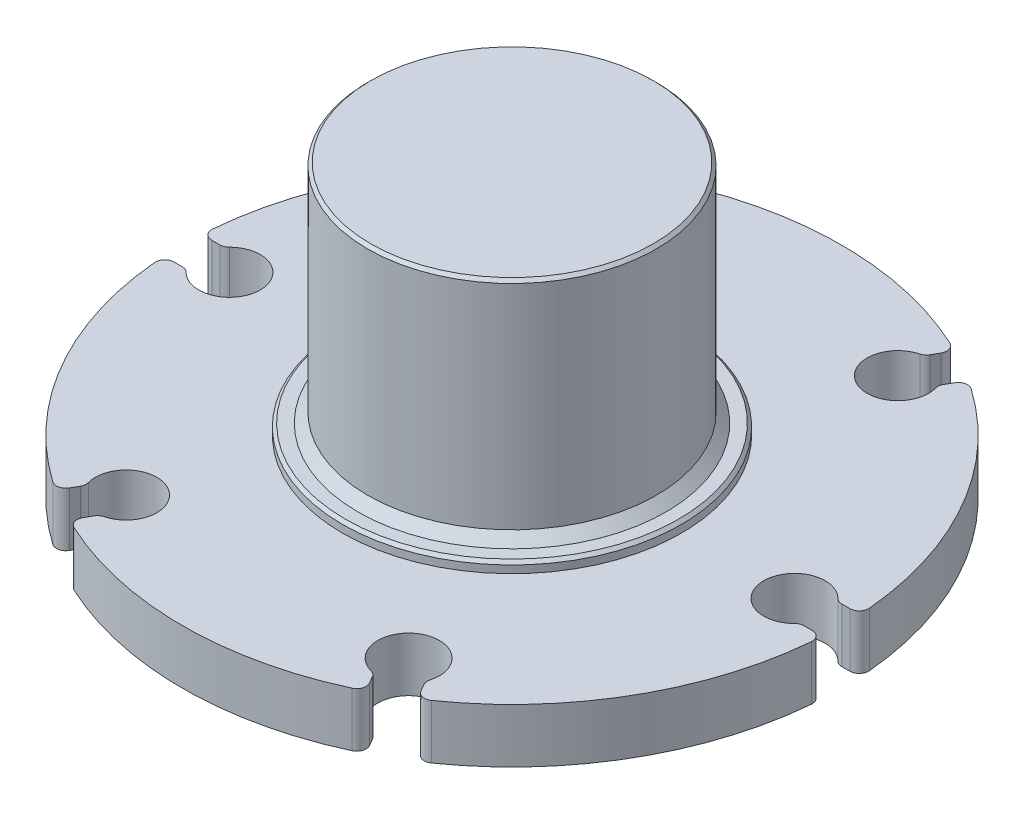
from build123d import *

# Parameters (mm, degrees)
SKETCH1_W           = 27.7876
SKETCH1_H           = 4.572
CUT_EXTRUDE1_DEPTH  = 40.562666891
CUT_EXTRUDE2_DEPTH  = 40.562666891
CUT_EXTRUDE3_DEPTH  = 40.562666891
CUT_EXTRUDE4_DEPTH  = 40.562666891
CUT_EXTRUDE5_DEPTH  = 40.530803878
CUT_EXTRUDE6_DEPTH  = 40.530803878
SKETCH8_R           = 14.2875
BOSS_EXTRUDE1_DEPTH = 0.889
SKETCH9_R           = 12.9794
BOSS_EXTRUDE2_DEPTH = 0.8128
BOSS_EXTRUDE2_TAPER = 45
SKETCH10_R          = 12.1666
BOSS_EXTRUDE3_DEPTH = 18.2372
BOSS_EXTRUDE4_START = 0.889
SKETCH11_R          = 14.2875
BOSS_EXTRUDE4_DEPTH = 0.889
CUT_EXTRUDE7_DEPTH  = 47.764743892
SKETCH13_W          = 2.5908
SKETCH13_H          = 4.572
SKETCH14_W          = 2.5908
SKETCH14_H          = 4.572
SKETCH15_W          = 2.5908
SKETCH15_H          = 4.572
SKETCH16_W          = 2.5908
SKETCH16_H          = 4.572
SKETCH17_W          = 2.5908
SKETCH17_H          = 4.572
SKETCH18_W          = 2.5908
SKETCH18_H          = 4.572
CHAMFER1_SIZE       = 0.254
FILLET1_R           = 0.127
FILLET2_R           = 0.7874
SKETCH19_R          = 9.350419414
BOSS_EXTRUDE7_DEPTH = 25.4


with BuildPart() as part:
    # Sketch1 → Revolve1 (revolve)
    with BuildSketch(Plane.XY, mode=Mode.PRIVATE) as revolve1_sk:
        with Locations((13.8938, 3.175)):
            Rectangle(SKETCH1_W, SKETCH1_H)
    revolve(revolve1_sk.sketch.rotate(Axis((0, 5.461, 0), (0, -1, 0)), 270), axis=Axis((0, 5.461, 0), (0, -1, 0)))

    # Sketch2 → Cut-Extrude1 (cut, through all)
    with BuildSketch(Plane.XZ.offset(-0.889)):
        with BuildLine():
            Line((-27.742216161, -1.5875), (-25.859959008, -1.5875))
            ThreePointArc((-25.859959008, -1.5875), (-26.4033, 0), (-25.859959008, 1.5875))
            Line((-25.859959008, 1.5875), (-27.742216161, 1.5875))
            ThreePointArc((-27.742216161, 1.5875), (-27.7876, 0), (-27.742216161, -1.5875))
        make_face()
    extrude(amount=-CUT_EXTRUDE1_DEPTH, mode=Mode.SUBTRACT)

    # Sketch3 → Cut-Extrude2 (cut, through all)
    with BuildSketch(Plane.XZ.offset(-0.889)):
        with BuildLine():
            Line((-15.245923409, 23.231713952), (-14.304794833, 21.601631442))
            ThreePointArc((-14.304794833, 21.601631442), (-13.20165, 22.865928544), (-11.555164176, 23.189131442))
            Line((-11.555164176, 23.189131442), (-12.496292752, 24.819213952))
            ThreePointArc((-12.496292752, 24.819213952), (-13.8938, 24.06476751), (-15.245923409, 23.231713952))
        make_face()
    extrude(amount=-CUT_EXTRUDE2_DEPTH, mode=Mode.SUBTRACT)

    # Sketch4 → Cut-Extrude3 (cut, through all)
    with BuildSketch(Plane.XZ.offset(-0.889)):
        with BuildLine():
            Line((12.496292752, 24.819213952), (11.555164176, 23.189131442))
            ThreePointArc((11.555164176, 23.189131442), (13.20165, 22.865928544), (14.304794833, 21.601631442))
            Line((14.304794833, 21.601631442), (15.245923409, 23.231713952))
            ThreePointArc((15.245923409, 23.231713952), (13.8938, 24.06476751), (12.496292752, 24.819213952))
        make_face()
    extrude(amount=-CUT_EXTRUDE3_DEPTH, mode=Mode.SUBTRACT)

    # Sketch5 → Cut-Extrude4 (cut, through all)
    with BuildSketch(Plane.XZ.offset(-0.889)):
        with BuildLine():
            Line((27.742216161, 1.5875), (25.859959008, 1.5875))
            ThreePointArc((25.859959008, 1.5875), (26.4033, 0), (25.859959008, -1.5875))
            Line((25.859959008, -1.5875), (27.742216161, -1.5875))
            ThreePointArc((27.742216161, -1.5875), (27.7876, 0), (27.742216161, 1.5875))
        make_face()
    extrude(amount=-CUT_EXTRUDE4_DEPTH, mode=Mode.SUBTRACT)

    # Sketch6 → Cut-Extrude5 (cut, through all)
    with BuildSketch(Plane.XZ.offset(-0.889)):
        with BuildLine():
            Line((15.245923409, -23.231713952), (14.304794833, -21.601631442))
            ThreePointArc((14.304794833, -21.601631442), (13.20165, -22.865928544), (11.555164176, -23.189131442))
            Line((11.555164176, -23.189131442), (12.496292752, -24.819213952))
            ThreePointArc((12.496292752, -24.819213952), (13.8938, -24.06476751), (15.245923409, -23.231713952))
        make_face()
    extrude(amount=-CUT_EXTRUDE5_DEPTH, mode=Mode.SUBTRACT)

    # Sketch7 → Cut-Extrude6 (cut, through all)
    with BuildSketch(Plane.XZ.offset(-0.889)):
        with BuildLine():
            Line((-12.496292752, -24.819213952), (-11.555164176, -23.189131442))
            ThreePointArc((-11.555164176, -23.189131442), (-13.20165, -22.865928544), (-14.304794833, -21.601631442))
            Line((-14.304794833, -21.601631442), (-15.245923409, -23.231713952))
            ThreePointArc((-15.245923409, -23.231713952), (-13.8938, -24.06476751), (-12.496292752, -24.819213952))
        make_face()
    extrude(amount=-CUT_EXTRUDE6_DEPTH, mode=Mode.SUBTRACT)

    # Sketch8 → Boss-Extrude1 (add)
    with BuildSketch(Plane(origin=(0, 5.461, 0), x_dir=(-1, 0, 0), z_dir=(0, 1, 0))):
        with Locations(Location((0, 0, 0), (0, 0, 90))):
            Circle(SKETCH8_R)
    extrude(amount=BOSS_EXTRUDE1_DEPTH)

    # Sketch9 → Boss-Extrude2 (add)
    with BuildSketch(Plane(origin=(0, 6.35, 0), x_dir=(-1, 0, 0), z_dir=(0, 1, 0))):
        Circle(SKETCH9_R)
    extrude(amount=BOSS_EXTRUDE2_DEPTH, taper=BOSS_EXTRUDE2_TAPER)

    # Sketch10 → Boss-Extrude3 (add)
    with BuildSketch(Plane(origin=(0, 7.1628, 0), x_dir=(-1, 0, 0), z_dir=(0, 1, 0))):
        with Locations(Location((0, 0, 0), (0, 0, 90))):
            Circle(SKETCH10_R)
    extrude(amount=BOSS_EXTRUDE3_DEPTH)

    # Sketch11 → Boss-Extrude4 (add)
    with BuildSketch(Plane.XZ.offset(-0.889).offset(BOSS_EXTRUDE4_START)):
        with Locations(Location((0, 0, 0), (0, 0, 90))):
            Circle(SKETCH11_R)
    extrude(amount=-BOSS_EXTRUDE4_DEPTH)

    # Sketch12 → Cut-Extrude7 (cut, through all)
    with BuildSketch(Plane.XZ):
        with BuildLine():
            Line((-8.0518, -1.65735), (-6.248228986, -1.65735))
            ThreePointArc((-6.248228986, -1.65735), (0, -6.4643), (6.248228986, -1.65735))
            Line((6.248228986, -1.65735), (8.0518, -1.65735))
            Line((8.0518, -1.65735), (8.0518, 1.65735))
            Line((8.0518, 1.65735), (6.248228986, 1.65735))
            ThreePointArc((6.248228986, 1.65735), (0, 6.4643), (-6.248228986, 1.65735))
            Line((-6.248228986, 1.65735), (-8.0518, 1.65735))
            Line((-8.0518, 1.65735), (-8.0518, -1.65735))
        make_face()
    extrude(amount=-CUT_EXTRUDE7_DEPTH, mode=Mode.SUBTRACT)

    # Sketch13 → Cut-Revolve1 (revolve, cut)
    with BuildSketch(Plane.XY):
        with Locations((-22.5171, 3.175)):
            Rectangle(SKETCH13_W, SKETCH13_H)
    revolve(axis=Axis((-23.8125, 5.461, 0), (0, -1, 0)), mode=Mode.SUBTRACT)

    # Sketch14 → Cut-Revolve2 (revolve, cut)
    with BuildSketch(Plane(origin=(0, 0, 20.622229928), x_dir=(-1, 0, 0), z_dir=(0, 0, -1))):
        with Locations((10.61085, 3.175)):
            Rectangle(SKETCH14_W, SKETCH14_H)
    revolve(axis=Axis((-11.90625, 0.889, 20.622229928), (0, 1, 0)), mode=Mode.SUBTRACT)

    # Sketch15 → Cut-Revolve3 (revolve, cut)
    with BuildSketch(Plane(origin=(0, 0, 20.622229928), x_dir=(-1, 0, 0), z_dir=(0, 0, -1))):
        with Locations((-13.20165, 3.175)):
            Rectangle(SKETCH15_W, SKETCH15_H)
    revolve(axis=Axis((11.90625, 0.889, 20.622229928), (0, 1, 0)), mode=Mode.SUBTRACT)

    # Sketch16 → Cut-Revolve4 (revolve, cut)
    with BuildSketch(Plane.XY):
        with Locations((25.1079, 3.175)):
            Rectangle(SKETCH16_W, SKETCH16_H)
    revolve(axis=Axis((23.8125, 5.461, 0), (0, -1, 0)), mode=Mode.SUBTRACT)

    # Sketch17 → Cut-Revolve5 (revolve, cut)
    with BuildSketch(Plane.XY.offset(-20.622229928)):
        with Locations((13.20165, 3.175)):
            Rectangle(SKETCH17_W, SKETCH17_H)
    revolve(axis=Axis((11.90625, 5.461, -20.622229928), (0, -1, 0)), mode=Mode.SUBTRACT)

    # Sketch18 → Cut-Revolve6 (revolve, cut)
    with BuildSketch(Plane.XY.offset(-20.622229928)):
        with Locations((-10.61085, 3.175)):
            Rectangle(SKETCH18_W, SKETCH18_H)
    revolve(axis=Axis((-11.90625, 5.461, -20.622229928), (0, -1, 0)), mode=Mode.SUBTRACT)

    # Chamfer1
    chamfer1_edges = [part.edges().sort_by_distance(p)[0] for p in [
        (0, 6.35, -14.2875),
        (0, 25.4, -12.1666),
        (0, 0, -14.2875),
        (0, 25.4, 6.4643),
        (0, 25.4, -6.4643),
        (0, 0, -6.4643),
        (0, 0, 6.4643),
    ]]
    chamfer(chamfer1_edges, length=CHAMFER1_SIZE)

    # Fillet1
    fillet1_edges = [part.edges().sort_by_distance(p)[0] for p in [
        (-6.248228986, 12.7, 1.65735),
        (-8.0518, 12.7, 1.65735),
        (-8.0518, 12.7, -1.65735),
        (6.248228986, 12.7, 1.65735),
        (-6.248228986, 12.7, -1.65735),
        (8.0518, 12.7, 1.65735),
        (8.0518, 12.7, -1.65735),
        (6.248228986, 12.7, -1.65735),
    ]]
    fillet(fillet1_edges, radius=FILLET1_R)

    # Fillet2
    fillet2_edges = [part.edges().sort_by_distance(p)[0] for p in [
        (-27.742216161, 3.175, -1.5875),
        (-27.742216161, 3.175, 1.5875),
        (-25.859959008, 3.175, 1.5875),
        (-25.859959008, 3.175, -1.5875),
        (-15.245923409, 3.175, 23.231713952),
        (-12.496292752, 3.175, 24.819213952),
        (-11.555164176, 3.175, 23.189131442),
        (-14.304794833, 3.175, 21.601631442),
        (12.496292752, 3.175, 24.819213952),
        (15.245923409, 3.175, 23.231713952),
        (14.304794833, 3.175, 21.601631442),
        (11.555164176, 3.175, 23.189131442),
        (27.742216161, 3.175, 1.5875),
        (27.742216161, 3.175, -1.5875),
        (25.859959008, 3.175, -1.5875),
        (25.859959008, 3.175, 1.5875),
        (15.245923409, 3.175, -23.231713952),
        (12.496292752, 3.175, -24.819213952),
        (11.555164176, 3.175, -23.189131442),
        (14.304794833, 3.175, -21.601631442),
        (-12.496292752, 3.175, -24.819213952),
        (-15.245923409, 3.175, -23.231713952),
        (-14.304794833, 3.175, -21.601631442),
        (-11.555164176, 3.175, -23.189131442),
    ]]
    fillet(fillet2_edges, radius=FILLET2_R)

    # Sketch19 → Boss-Extrude7 (add)
    with BuildSketch(Plane(origin=(0, 25.4, 0), x_dir=(1, 0, 0), z_dir=(0, 1, 0))):
        Circle(SKETCH19_R)
    extrude(amount=-BOSS_EXTRUDE7_DEPTH)


solid = part.part
